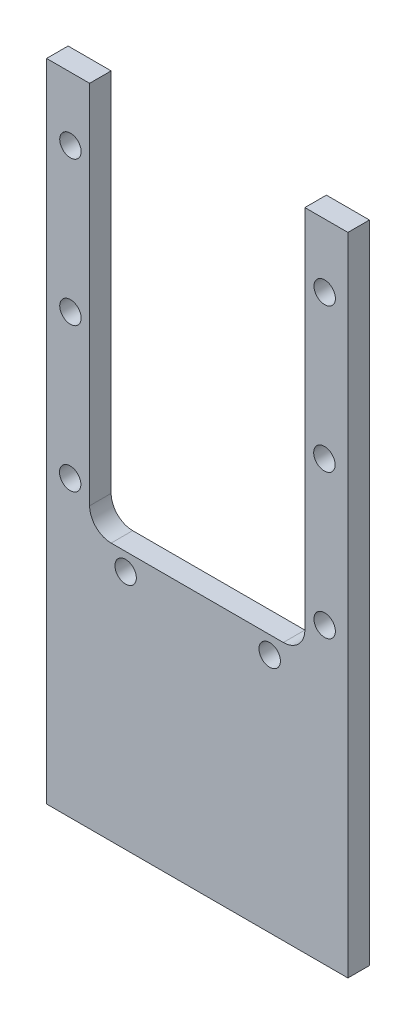
from build123d import *

# Parameters (mm, degrees)
BOSS_EXTRUDE1_DEPTH          = 2.54
FILLET1_R                    = 2.54
F_39_0_0995_DIAMETER_HOLE1_D = 2.5273


with BuildPart() as part:
    # Sketch1 → Boss-Extrude1 (new body)
    with BuildSketch(Plane.XY):
        Polygon((0, 0), (0, 76.2), (5.08, 76.2), (5.08, 30.48), (30.48, 30.48), (30.48, 76.2), (35.56, 76.2), (35.56, 0), align=None)
    extrude(amount=BOSS_EXTRUDE1_DEPTH)

    # Fillet1
    fillet1_edges = [part.edges().sort_by_distance(p)[0] for p in [
        (5.08, 30.48, 1.27),
        (30.48, 30.48, 1.27),
    ]]
    fillet(fillet1_edges, radius=FILLET1_R)

    # #39 (0.0995) Diameter Hole1 (through all)
    with Locations(Plane.XY.offset(2.54)):
        with Locations((32.820840104, 68.709866644), (32.784904498, 51.685945396), (32.816003505, 34.693675088), (26.329237865, 28.403700876), (9.329223304, 28.403700876), (2.784904498, 34.68594536), (2.816003505, 51.696905496), (2.816003505, 68.709866644)):
            Hole(F_39_0_0995_DIAMETER_HOLE1_D / 2)


solid = part.part
